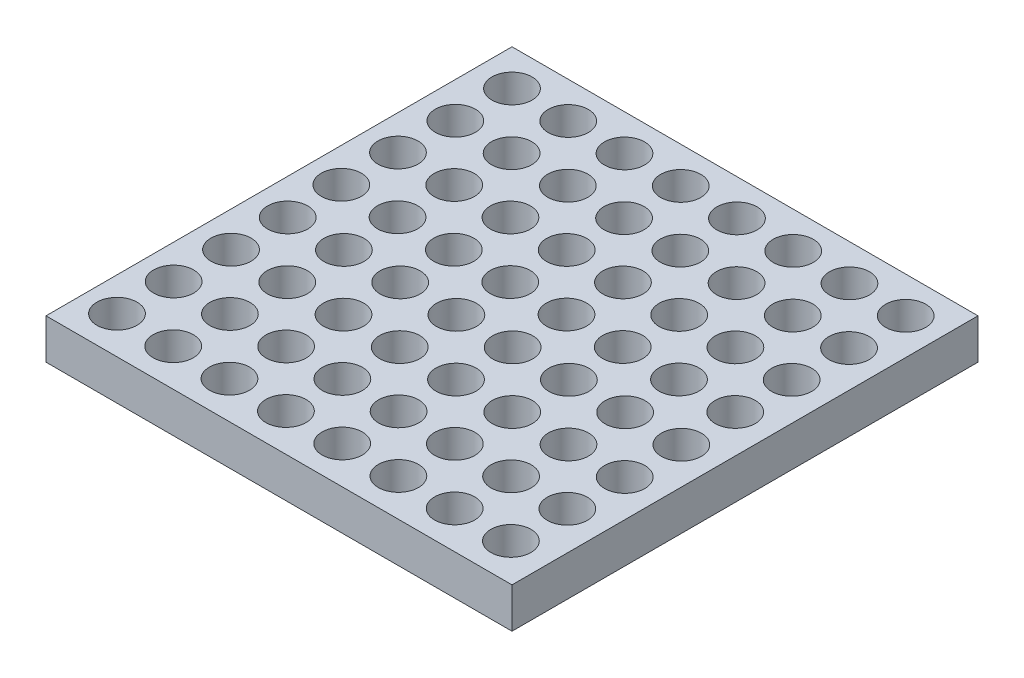
from build123d import *

# Parameters (mm, degrees)
SKETCH2_W           = 58
SKETCH2_H           = 58
BOSS_EXTRUDE1_DEPTH = 5
SKETCH3_R           = 2.5
CUT_EXTRUDE1_DEPTH  = 5


with BuildPart() as part:
    # Sketch2 → Boss-Extrude1 (new body)
    with BuildSketch(Plane(origin=(0, 0, 0), x_dir=(1, 0, 0), z_dir=(0, 1, 0))):
        Rectangle(SKETCH2_W, SKETCH2_H)
    extrude(amount=BOSS_EXTRUDE1_DEPTH)

    # Sketch3 → Cut-Extrude1 (cut)
    with BuildSketch(Plane(origin=(0, 5, 0), x_dir=(1, 0, 0), z_dir=(0, 1, 0))):
        with Locations(Location((-24.5, 24.5, 0), (0, 0, 270))):
            Circle(SKETCH3_R)
        with Locations(Location((-17.5, 24.5, 0), (0, 0, 270))):
            Circle(SKETCH3_R)
        with Locations(Location((-10.5, 24.5, 0), (0, 0, 270))):
            Circle(SKETCH3_R)
        with Locations(Location((-3.5, 24.5, 0), (0, 0, 270))):
            Circle(SKETCH3_R)
        with Locations(Location((3.5, 24.5, 0), (0, 0, 270))):
            Circle(SKETCH3_R)
        with Locations(Location((10.5, 24.5, 0), (0, 0, 270))):
            Circle(SKETCH3_R)
        with Locations(Location((17.5, 24.5, 0), (0, 0, 270))):
            Circle(SKETCH3_R)
        with Locations(Location((24.5, 24.5, 0), (0, 0, 270))):
            Circle(SKETCH3_R)
        with Locations(Location((-24.550572602, 17.500182687, 0), (0, 0, 270))):
            Circle(SKETCH3_R)
        with Locations(Location((-17.550572602, 17.500182687, 0), (0, 0, 270))):
            Circle(SKETCH3_R)
        with Locations(Location((-10.550572602, 17.500182687, 0), (0, 0, 270))):
            Circle(SKETCH3_R)
        with Locations(Location((-3.550572602, 17.500182687, 0), (0, 0, 270))):
            Circle(SKETCH3_R)
        with Locations(Location((3.449427398, 17.500182687, 0), (0, 0, 270))):
            Circle(SKETCH3_R)
        with Locations(Location((10.449427398, 17.500182687, 0), (0, 0, 270))):
            Circle(SKETCH3_R)
        with Locations(Location((17.449427398, 17.500182687, 0), (0, 0, 270))):
            Circle(SKETCH3_R)
        with Locations(Location((24.449427398, 17.500182687, 0), (0, 0, 270))):
            Circle(SKETCH3_R)
        with Locations(Location((-24.693395084, 10.500182687, 0), (0, 0, 270))):
            Circle(SKETCH3_R)
        with Locations(Location((-17.693395084, 10.500182687, 0), (0, 0, 270))):
            Circle(SKETCH3_R)
        with Locations(Location((-10.693395084, 10.500182687, 0), (0, 0, 270))):
            Circle(SKETCH3_R)
        with Locations(Location((-3.693395084, 10.500182687, 0), (0, 0, 270))):
            Circle(SKETCH3_R)
        with Locations(Location((3.306604916, 10.500182687, 0), (0, 0, 270))):
            Circle(SKETCH3_R)
        with Locations(Location((10.306604916, 10.500182687, 0), (0, 0, 270))):
            Circle(SKETCH3_R)
        with Locations(Location((17.306604916, 10.500182687, 0), (0, 0, 270))):
            Circle(SKETCH3_R)
        with Locations(Location((24.306604916, 10.500182687, 0), (0, 0, 270))):
            Circle(SKETCH3_R)
        with Locations(Location((-24.744162739, 3.500366786, 0), (0, 0, 270))):
            Circle(SKETCH3_R)
        with Locations(Location((-17.743967685, 3.500182687, 0), (0, 0, 270))):
            Circle(SKETCH3_R)
        with Locations(Location((-10.744162739, 3.500366786, 0), (0, 0, 270))):
            Circle(SKETCH3_R)
        with Locations(Location((-3.743967685, 3.52726064, 0), (0, 0, 270))):
            Circle(SKETCH3_R)
        with Locations(Location((3.256032315, 3.52726064, 0), (0, 0, 270))):
            Circle(SKETCH3_R)
        with Locations(Location((10.256032315, 3.52726064, 0), (0, 0, 270))):
            Circle(SKETCH3_R)
        with Locations(Location((17.256032315, 3.52726064, 0), (0, 0, 270))):
            Circle(SKETCH3_R)
        with Locations(Location((24.256032315, 3.52726064, 0), (0, 0, 270))):
            Circle(SKETCH3_R)
        with Locations(Location((-24.561453235, -3.359376803, 0), (0, 0, 270))):
            Circle(SKETCH3_R)
        with Locations(Location((-17.561453235, -3.359376803, 0), (0, 0, 270))):
            Circle(SKETCH3_R)
        with Locations(Location((-10.561453235, -3.359376803, 0), (0, 0, 270))):
            Circle(SKETCH3_R)
        with Locations(Location((-3.561453235, -3.359376803, 0), (0, 0, 270))):
            Circle(SKETCH3_R)
        with Locations(Location((3.438546765, -3.359376803, 0), (0, 0, 270))):
            Circle(SKETCH3_R)
        with Locations(Location((10.438546765, -3.359376803, 0), (0, 0, 270))):
            Circle(SKETCH3_R)
        with Locations(Location((17.438546765, -3.359376803, 0), (0, 0, 270))):
            Circle(SKETCH3_R)
        with Locations(Location((24.438546765, -3.359376803, 0), (0, 0, 270))):
            Circle(SKETCH3_R)
        with Locations(Location((-24.612025837, -10.359194116, 0), (0, 0, 270))):
            Circle(SKETCH3_R)
        with Locations(Location((-17.612025837, -10.359194116, 0), (0, 0, 270))):
            Circle(SKETCH3_R)
        with Locations(Location((-10.612025837, -10.359194116, 0), (0, 0, 270))):
            Circle(SKETCH3_R)
        with Locations(Location((-3.612025837, -10.359194116, 0), (0, 0, 270))):
            Circle(SKETCH3_R)
        with Locations(Location((3.387974163, -10.359194116, 0), (0, 0, 270))):
            Circle(SKETCH3_R)
        with Locations(Location((10.387974163, -10.359194116, 0), (0, 0, 270))):
            Circle(SKETCH3_R)
        with Locations(Location((17.387974163, -10.359194116, 0), (0, 0, 270))):
            Circle(SKETCH3_R)
        with Locations(Location((24.387974163, -10.359194116, 0), (0, 0, 270))):
            Circle(SKETCH3_R)
        with Locations(Location((-24.754848319, -17.359194116, 0), (0, 0, 270))):
            Circle(SKETCH3_R)
        with Locations(Location((-17.754848319, -17.359194116, 0), (0, 0, 270))):
            Circle(SKETCH3_R)
        with Locations(Location((-10.754848319, -17.359194116, 0), (0, 0, 270))):
            Circle(SKETCH3_R)
        with Locations(Location((-3.754848319, -17.359194116, 0), (0, 0, 270))):
            Circle(SKETCH3_R)
        with Locations(Location((3.245151681, -17.359194116, 0), (0, 0, 270))):
            Circle(SKETCH3_R)
        with Locations(Location((10.245151681, -17.359194116, 0), (0, 0, 270))):
            Circle(SKETCH3_R)
        with Locations(Location((17.245151681, -17.359194116, 0), (0, 0, 270))):
            Circle(SKETCH3_R)
        with Locations(Location((24.245151681, -17.359194116, 0), (0, 0, 270))):
            Circle(SKETCH3_R)
        with Locations(Location((-24.805615974, -24.359010017, 0), (0, 0, 270))):
            Circle(SKETCH3_R)
        with Locations(Location((-17.805420921, -24.359194116, 0), (0, 0, 270))):
            Circle(SKETCH3_R)
        with Locations(Location((-10.805615974, -24.359010017, 0), (0, 0, 270))):
            Circle(SKETCH3_R)
        with Locations(Location((-3.805420921, -24.332116163, 0), (0, 0, 270))):
            Circle(SKETCH3_R)
        with Locations(Location((3.194579079, -24.332116163, 0), (0, 0, 270))):
            Circle(SKETCH3_R)
        with Locations(Location((10.194579079, -24.332116163, 0), (0, 0, 270))):
            Circle(SKETCH3_R)
        with Locations(Location((17.194579079, -24.332116163, 0), (0, 0, 270))):
            Circle(SKETCH3_R)
        with Locations(Location((24.194579079, -24.332116163, 0), (0, 0, 270))):
            Circle(SKETCH3_R)
    extrude(amount=-CUT_EXTRUDE1_DEPTH, mode=Mode.SUBTRACT)


solid = part.part
